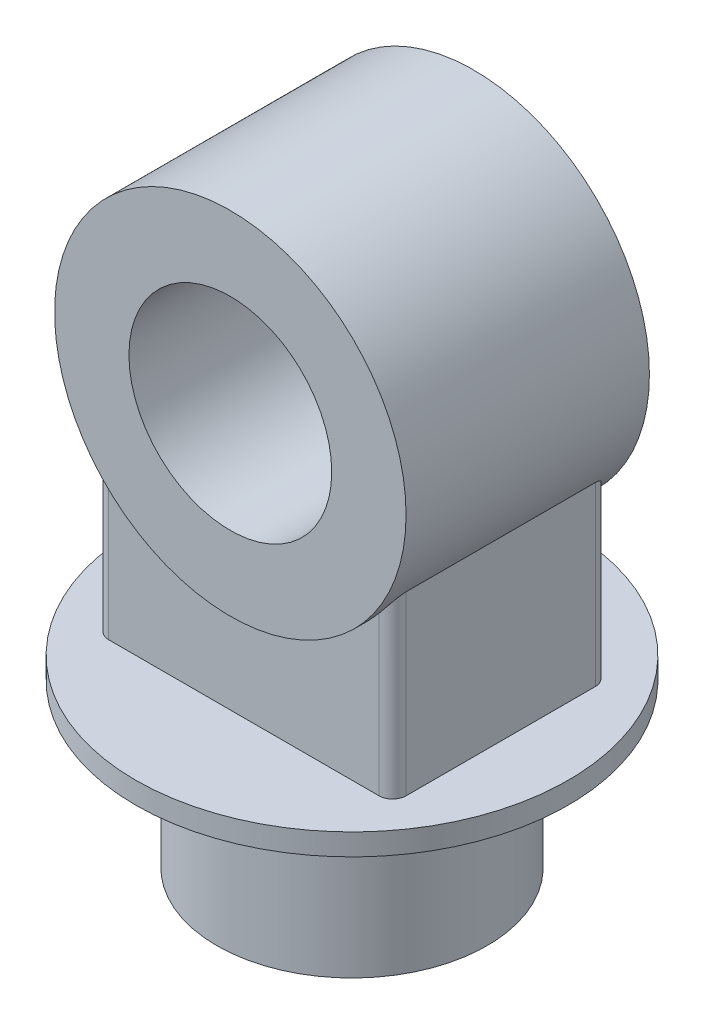
from build123d import *

# Parameters (mm, degrees)
SKETCH1_R                = 100
BOSS_EXTRUDE1_DEPTH      = 120
SKETCH2_R                = 160
BOSS_EXTRUDE2_DEPTH      = 16
SKETCH3_R                = 130
SKETCH3_R_2              = 75
BOSS_EXTRUDE4_DEPTH      = 90
BOSS_EXTRUDE5_REACH      = 402.125
BOSS_EXTRUDE5_END_RADIUS = 130
SKETCH4_W                = 220
SKETCH4_H                = 160
FILLET1_R                = 10


with BuildPart() as part:
    # Sketch1 → Boss-Extrude1 (new body)
    with BuildSketch(Plane(origin=(0, 0, 0), x_dir=(1, 0, 0), z_dir=(0, 1, 0))):
        with Locations(Location((0, 0, 0), (0, 0, 270))):
            Circle(SKETCH1_R)
    extrude(amount=BOSS_EXTRUDE1_DEPTH)

    # Sketch2 → Boss-Extrude2 (add)
    with BuildSketch(Plane(origin=(0, 120, 0), x_dir=(1, 0, 0), z_dir=(0, 1, 0))):
        with Locations(Location((0, 0, 0), (0, 0, 270))):
            Circle(SKETCH2_R)
    extrude(amount=BOSS_EXTRUDE2_DEPTH)



with BuildPart() as body_2:
    # Sketch3 → Boss-Extrude4 (new, symmetric)
    with BuildSketch(Plane.XY):
        with Locations(Location((0, 336, 0), (0, 0, 180))):
            Circle(SKETCH3_R)
        with Locations(Location((0, 336, 0), (0, 0, 180))):
            Circle(SKETCH3_R_2, mode=Mode.SUBTRACT)
    extrude(amount=BOSS_EXTRUDE4_DEPTH, both=True)


with BuildPart() as part_1:
    add(part.part)

    add(body_2.part)  # Boss-Extrude5 merges body 2
    # Boss-Extrude5: up to this cylinder (the profile starts outside it)
    boss_extrude5_end = Plane(origin=(0, 336, 0), z_dir=(0, 0, -1)) * Cylinder(BOSS_EXTRUDE5_END_RADIUS, 1065.25, mode=Mode.PRIVATE)
    # Sketch4 → Boss-Extrude5 (add, up to the surface)
    with BuildSketch(Plane(origin=(0, 136, 0), x_dir=(1, 0, 0), z_dir=(0, 1, 0)), mode=Mode.PRIVATE) as boss_extrude5_sk1:
        Rectangle(SKETCH4_W, SKETCH4_H)
    boss_extrude5_tool1 = extrude(boss_extrude5_sk1.sketch, amount=BOSS_EXTRUDE5_REACH, mode=Mode.PRIVATE) - boss_extrude5_end
    add(boss_extrude5_tool1.solids().sort_by_distance((0, 136, 0))[0])

    # Fillet1
    fillet1_edges = [part_1.edges().sort_by_distance(p)[0] for p in [
        (110, 201.358983849, -80),
        (110, 201.358983849, 80),
        (-110, 201.358983849, -80),
        (-110, 201.358983849, 80),
    ]]
    fillet(fillet1_edges, radius=FILLET1_R)


solid = part_1.part
